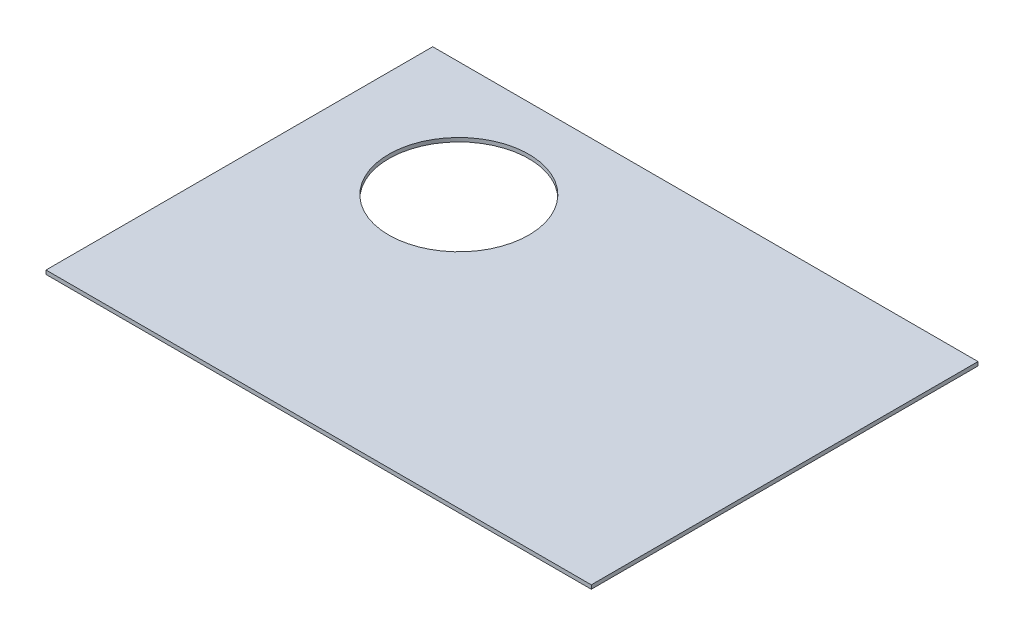
from build123d import *

# Parameters (mm, degrees)
BOSS_EXTRUDE1_DEPTH = 3.175
SKETCH4_R           = 57.5
CUT_EXTRUDE3_DEPTH  = 549.843544419


with BuildPart() as part:
    # Sketch1 → Boss-Extrude1 (new body)
    with BuildSketch(Plane(origin=(0, 0, 0), x_dir=(1, 0, 0), z_dir=(0, 1, 0))):
        Polygon((401.6375, 0), (447.675, 0), (447.675, 317.5), (0, 317.5), (0, 0), (46.0375, 0), align=None)
    extrude(amount=BOSS_EXTRUDE1_DEPTH)

    # Sketch4 → Cut-Extrude3 (cut, through all)
    with BuildSketch(Plane(origin=(0, 3.175, 0), x_dir=(1, 0, 0), z_dir=(0, 1, 0))):
        with Locations(Location((115.8875, 223.04375, 0), (0, 0, 270))):
            Circle(SKETCH4_R)
    extrude(amount=-CUT_EXTRUDE3_DEPTH, mode=Mode.SUBTRACT)


solid = part.part
